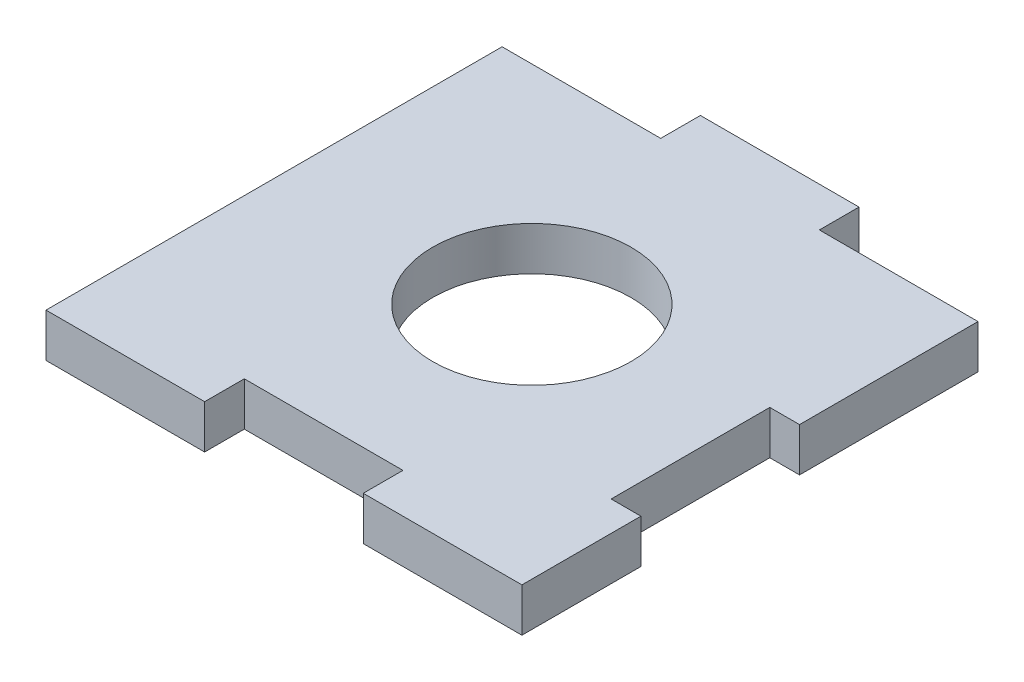
from build123d import *

# Parameters (mm, degrees)
SKETCH1_R           = 5
BOSS_EXTRUDE1_DEPTH = 2.2


with BuildPart() as part:
    # Sketch1 → Boss-Extrude1 (new body)
    with BuildSketch(Plane(origin=(0, 0, 0), x_dir=(1, 0, 0), z_dir=(0, 1, 0))):
        Polygon((-145.195425431, -13.597712716), (-145.195425431, -11.597712716), (-153.195425431, -11.597712716), (-153.195425431, -13.597712716), (-161.195425431, -13.597712716), (-161.195425431, -36.597712716), (-153.195425431, -36.597712716), (-153.195425431, -34.597712716), (-145.195425431, -34.597712716), (-145.195425431, -36.597712716), (-137.195425431, -36.597712716), (-137.195425431, -30.597712716), (-138.695425431, -30.597712716), (-138.695425431, -22.597712716), (-137.195425431, -22.597712716), (-137.195425431, -16.597712716), (-137.195425431, -13.597712716), align=None)
        with Locations(Location((-149.195425431, -24.097712716, 0), (0, 0, 270))):
            Circle(SKETCH1_R, mode=Mode.SUBTRACT)
    extrude(amount=BOSS_EXTRUDE1_DEPTH)


solid = part.part
